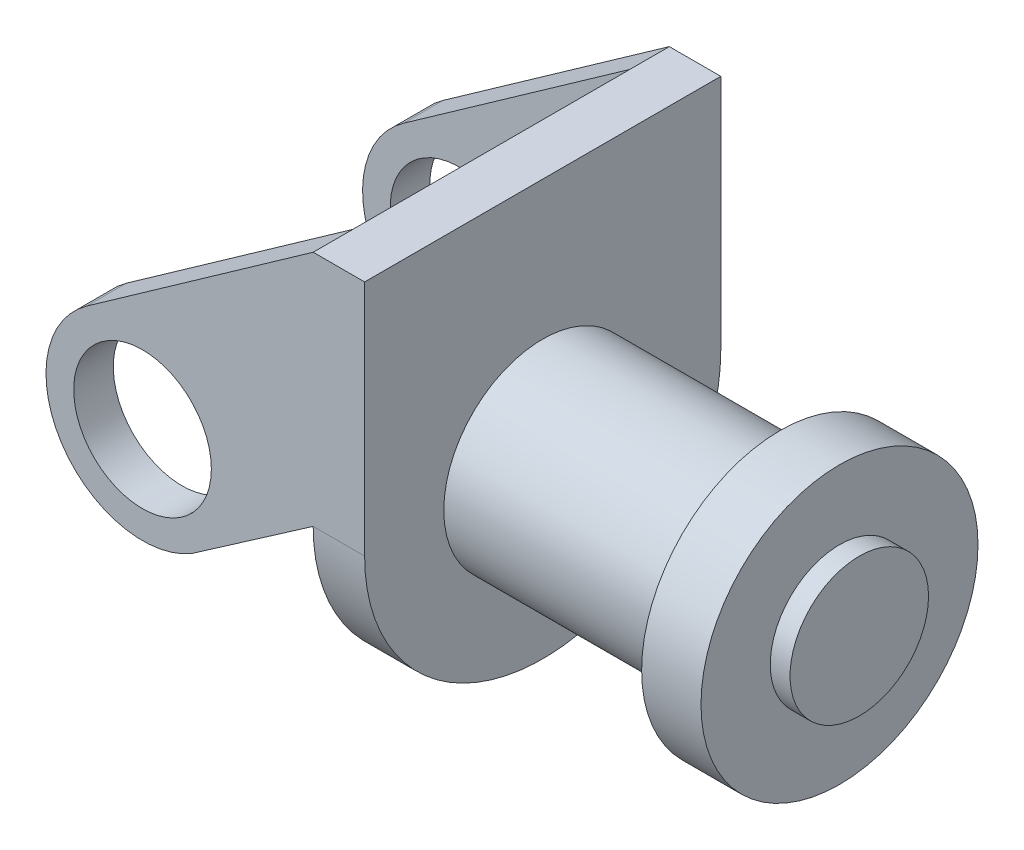
from build123d import *

# Parameters (mm, degrees)
BOSS_EXTRUDE1_DEPTH = 0.013
SKETCH2_R           = 0.025
BOSS_EXTRUDE2_DEPTH = 0.075
SKETCH3_R           = 0.035
SKETCH3_R_2         = 0.025
BOSS_EXTRUDE3_DEPTH = 0.015
SKETCH4_R           = 0.0175
BOSS_EXTRUDE4_DEPTH = 0.005
BOSS_EXTRUDE5_DEPTH = 0.01
SKETCH6_R           = 0.01739422
CUT_EXTRUDE1_DEPTH  = 1.166655333


with BuildPart() as part:
    # Sketch1 → Boss-Extrude1 (new body)
    with BuildSketch(Plane(origin=(0, 0, 0), x_dir=(0, 0, -1), z_dir=(1, 0, 0))):
        with BuildLine():
            Line((-0.045, 0), (0.045, 0))
            Line((0.045, 0), (0.045, -0.06))
            ThreePointArc((0.045, -0.06), (0, -0.105), (-0.045, -0.06))
            Line((-0.045, -0.06), (-0.045, 0))
        make_face()
    extrude(amount=BOSS_EXTRUDE1_DEPTH)

    # Sketch2 → Boss-Extrude2 (add)
    with BuildSketch(Plane(origin=(0.013, 0, 0), x_dir=(0, 0, -1), z_dir=(1, 0, 0))):
        with Locations((0, -0.06)):
            Circle(SKETCH2_R)
    extrude(amount=BOSS_EXTRUDE2_DEPTH)

    # Sketch3 → Boss-Extrude3 (add)
    with BuildSketch(Plane(origin=(0.073, 0, 0), x_dir=(0, 0, -1), z_dir=(1, 0, 0))):
        with Locations((0, -0.06)):
            Circle(SKETCH3_R)
        with Locations((0, -0.06)):
            Circle(SKETCH3_R_2, mode=Mode.SUBTRACT)
    extrude(amount=BOSS_EXTRUDE3_DEPTH)

    # Sketch4 → Boss-Extrude4 (add)
    with BuildSketch(Plane(origin=(0.088, 0, 0), x_dir=(0, 0, -1), z_dir=(1, 0, 0))):
        with Locations((0, -0.06)):
            Circle(SKETCH4_R)
    extrude(amount=BOSS_EXTRUDE4_DEPTH)

    # Sketch5 → Boss-Extrude5 (add)
    with BuildSketch(Plane(origin=(0, 0, -0.045), x_dir=(-1, 0, 0), z_dir=(0, 0, -1))):
        with BuildLine():
            Line((0, 0), (0.057189107, -0.040365902))
            ThreePointArc((0.057189107, -0.040365902), (0.063607261, -0.073540807), (0.030720733, -0.081302466))
            Line((0.030720733, -0.081302466), (0, -0.06))
            Line((0, -0.06), (-0.013, -0.06))
            Line((-0.013, -0.06), (-0.013, 0))
            Line((-0.013, 0), (0, 0))
        make_face()
    boss_extrude5 = extrude(amount=-BOSS_EXTRUDE5_DEPTH)

    # Mirror1: Boss-Extrude5 across plane
    add(boss_extrude5.mirror(Plane.XY))

    # Sketch6 → Cut-Extrude1 (cut, through all)
    with BuildSketch(Plane.XY.offset(0.045)):
        with Locations((-0.04312204, -0.060295668)):
            Circle(SKETCH6_R)
    extrude(amount=-CUT_EXTRUDE1_DEPTH, mode=Mode.SUBTRACT)


solid = part.part
